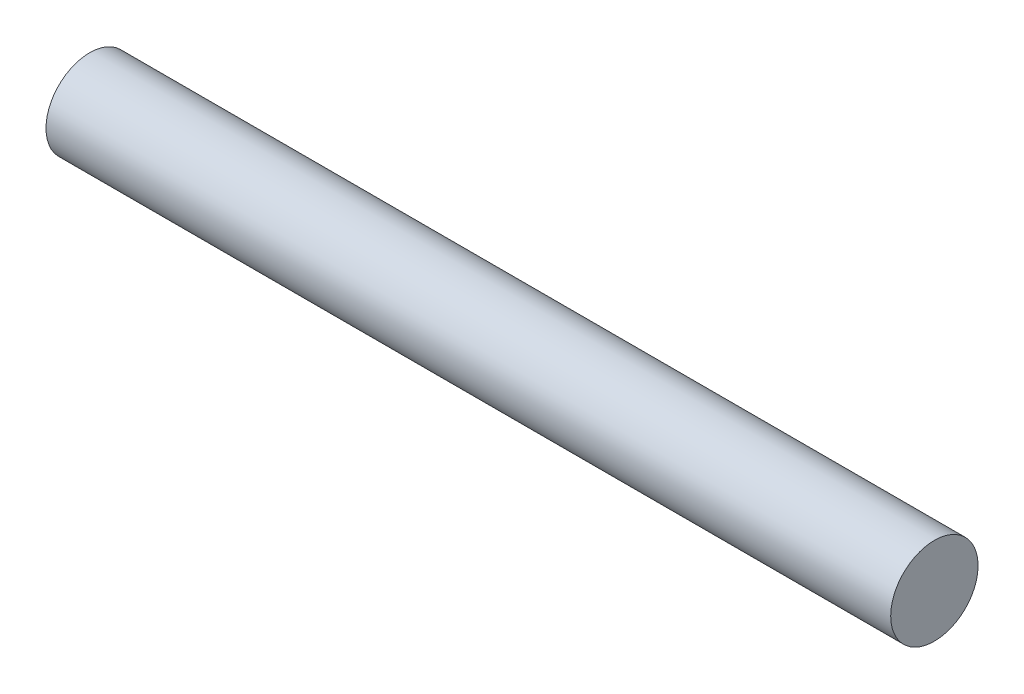
from build123d import *

# Parameters (mm, degrees)
SKETCH1_R           = 1.5
BOSS_EXTRUDE2_DEPTH = 29


with BuildPart() as part:
    # Sketch1 → Boss-Extrude2 (new body)
    with BuildSketch(Plane(origin=(0, 0, 0), x_dir=(0, 0, -1), z_dir=(1, 0, 0))):
        with Locations(Location((0, 0, 0), (0, 0, 180))):
            Circle(SKETCH1_R)
    extrude(amount=BOSS_EXTRUDE2_DEPTH)


solid = part.part
